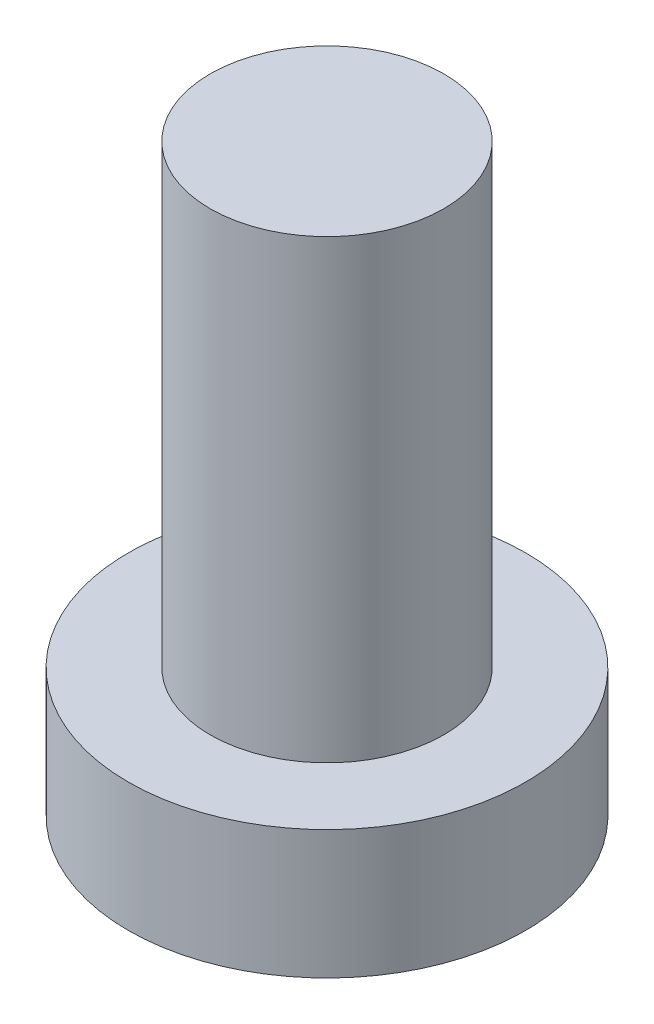
from build123d import *

# Parameters (mm, degrees)
SKETCH1_R           = 6.8
BOSS_EXTRUDE1_DEPTH = 4.4
SKETCH2_R           = 4
BOSS_EXTRUDE2_DEPTH = 15.6


with BuildPart() as part:
    # Sketch1 → Boss-Extrude1 (new body)
    with BuildSketch(Plane(origin=(0, 0, 0), x_dir=(1, 0, 0), z_dir=(0, 1, 0))):
        with Locations(Location((0, 0, 0), (0, 0, 270))):
            Circle(SKETCH1_R)
    extrude(amount=BOSS_EXTRUDE1_DEPTH)

    # Sketch2 → Boss-Extrude2 (add)
    with BuildSketch(Plane(origin=(0, 4.4, 0), x_dir=(1, 0, 0), z_dir=(0, 1, 0))):
        with Locations(Location((0, 0, 0), (0, 0, 270))):
            Circle(SKETCH2_R)
    extrude(amount=BOSS_EXTRUDE2_DEPTH)


solid = part.part
